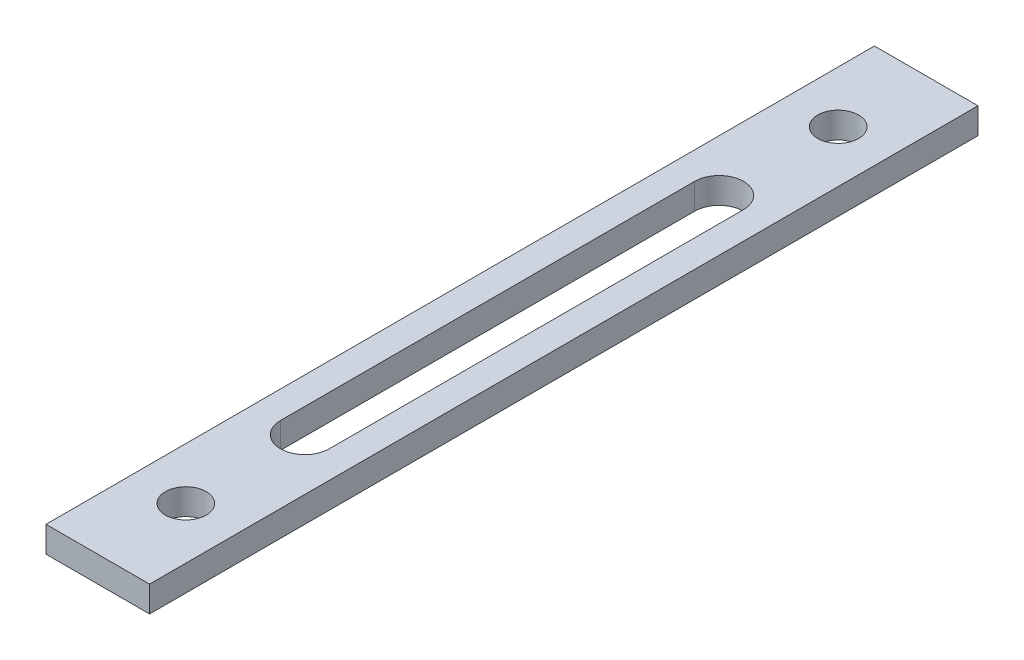
from build123d import *

# Parameters (mm, degrees)
SKETCH1_W           = 25.4
SKETCH1_H           = 203.2
BOSS_EXTRUDE1_DEPTH = 6.35
SKETCH2_R           = 5
CUT_EXTRUDE1_DEPTH  = 103.587389576
CUT_EXTRUDE2_DEPTH  = 103.587389576


with BuildPart() as part:
    # Sketch1 → Boss-Extrude1 (new body)
    with BuildSketch(Plane(origin=(0, 0, 0), x_dir=(1, 0, 0), z_dir=(0, 1, 0))):
        Rectangle(SKETCH1_W, SKETCH1_H)
    extrude(amount=BOSS_EXTRUDE1_DEPTH)

    # Sketch2 → Cut-Extrude1 (cut, through all)
    with BuildSketch(Plane(origin=(0, 6.35, 0), x_dir=(1, 0, 0), z_dir=(0, 1, 0))):
        with Locations(Location((0, -80, 0), (0, 0, 270))):
            Circle(SKETCH2_R)
        with Locations(Location((0, 80, 0), (0, 0, 270))):
            Circle(SKETCH2_R)
    extrude(amount=-CUT_EXTRUDE1_DEPTH, mode=Mode.SUBTRACT)

    # Sketch3 → Cut-Extrude2 (cut, through all)
    with BuildSketch(Plane(origin=(0, 6.35, 0), x_dir=(1, 0, 0), z_dir=(0, 1, 0))):
        with BuildLine():
            Line((6, 50.8), (6, -50.8))
            ThreePointArc((6, -50.8), (0, -56.8), (-6, -50.8))
            Line((-6, -50.8), (-6, 50.8))
            ThreePointArc((-6, 50.8), (0, 56.8), (6, 50.8))
        make_face()
    extrude(amount=-CUT_EXTRUDE2_DEPTH, mode=Mode.SUBTRACT)


solid = part.part
